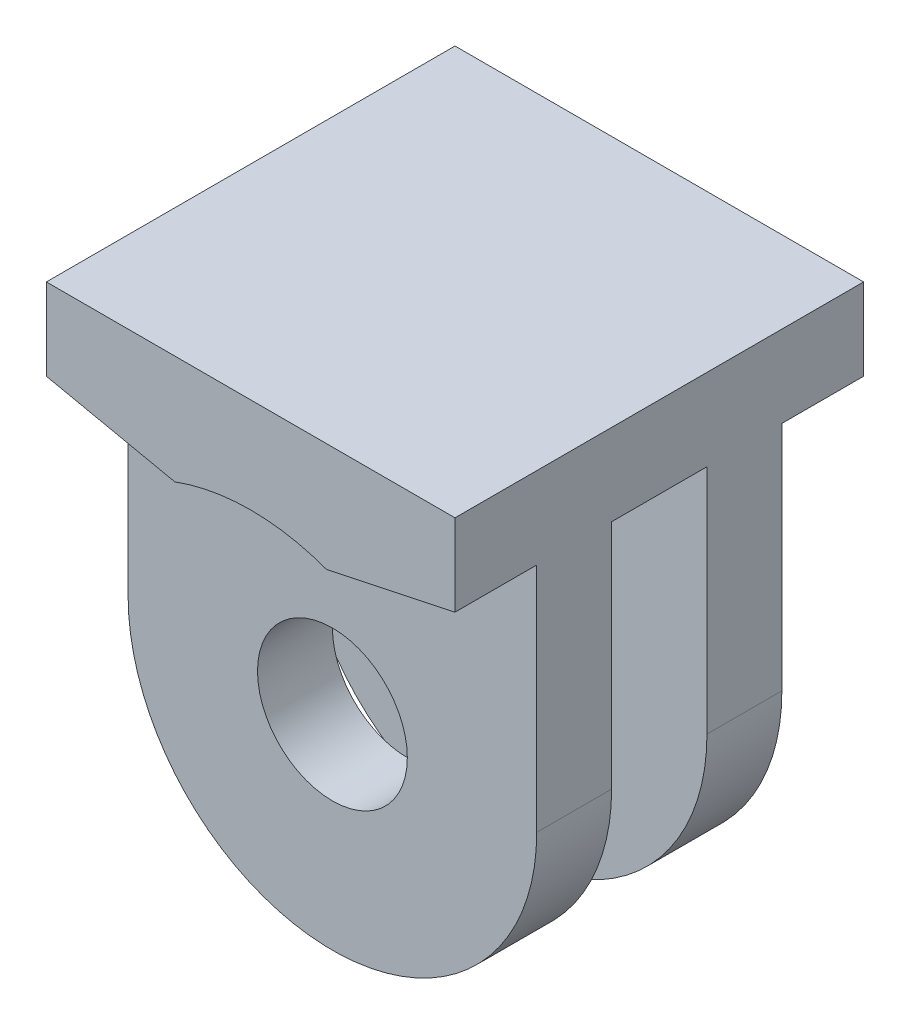
from build123d import *

# Parameters (mm, degrees)
SKETCH1_W           = 15
SKETCH1_H           = 7.5
BOSS_EXTRUDE1_DEPTH = 4
SKETCH3_W           = 15
SKETCH3_H           = 2.75
BOSS_EXTRUDE3_DEPTH = 15
CUT_EXTRUDE2_DEPTH  = 22.685248442
SKETCH6_R           = 2.75
CUT_EXTRUDE3_DEPTH  = 23.5
SKETCH10_R          = 8
CUT_EXTRUDE6_DEPTH  = 3
CUT_EXTRUDE9_START  = -1.75
SKETCH13_R          = 8
CUT_EXTRUDE9_DEPTH  = 1.75
CUT_EXTRUDE8_DEPTH  = 3
CUT_EXTRUDE10_DEPTH = 1.75


with BuildPart() as part:
    # Sketch1 → Boss-Extrude1 (new body)
    with BuildSketch(Plane(origin=(0, 0, 0), x_dir=(1, 0, 0), z_dir=(0, 1, 0))):
        with Locations((7.5, 3.75)):
            Rectangle(SKETCH1_W, SKETCH1_H)
    extrude(amount=BOSS_EXTRUDE1_DEPTH)

    # Sketch3 → Boss-Extrude3 (add)
    with BuildSketch(Plane.XZ):
        with Locations((7.5, -3.125)):
            Rectangle(SKETCH3_W, SKETCH3_H)
    extrude(amount=BOSS_EXTRUDE3_DEPTH)

    # Sketch5 → Cut-Extrude2 (cut, through all)
    with BuildSketch(Plane(origin=(0, 0, -4.5), x_dir=(-1, 0, 0), z_dir=(0, 0, -1))):
        with BuildLine():
            Line((-15, -7.5), (-15, -17.341994959))
            Line((-15, -17.341994959), (0, -17.341994959))
            Line((0, -17.341994959), (0, -7.5))
            ThreePointArc((0, -7.5), (-7.5, -15), (-15, -7.5))
        make_face()
    extrude(amount=-CUT_EXTRUDE2_DEPTH, mode=Mode.SUBTRACT)

    # Sketch6 → Cut-Extrude3 (cut, through all)
    with BuildSketch(Plane(origin=(0, 0, -7.5), x_dir=(-1, 0, 0), z_dir=(0, 0, -1))):
        with Locations((-7.5, -7.5)):
            Circle(SKETCH6_R)
    extrude(amount=-CUT_EXTRUDE3_DEPTH, mode=Mode.SUBTRACT)

    # Sketch10 → Cut-Extrude6 (cut)
    with BuildSketch(Plane(origin=(0, 0, -7.5), x_dir=(-1, 0, 0), z_dir=(0, 0, -1))):
        with Locations((-7.5, -7.5)):
            Circle(SKETCH10_R)
    extrude(amount=-CUT_EXTRUDE6_DEPTH, mode=Mode.SUBTRACT)

    # Sketch13 → Cut-Extrude9 (cut)
    with BuildSketch(Plane.XY.offset(CUT_EXTRUDE9_START)):
        with Locations((7.5, -7.5)):
            Circle(SKETCH13_R)
    extrude(amount=CUT_EXTRUDE9_DEPTH, mode=Mode.SUBTRACT)

    # Sketch12 → Cut-Extrude8 (cut)
    with BuildSketch(Plane(origin=(0, 0, -7.5), x_dir=(-1, 0, 0), z_dir=(0, 0, -1))):
        Polygon((-10.283882181, 0), (-15, 1), (-15, 0), align=None)
        Polygon((-4.716117819, 0), (0, 1), (0, 0), align=None)
    extrude(amount=-CUT_EXTRUDE8_DEPTH, mode=Mode.SUBTRACT)

    # Sketch14 → Cut-Extrude10 (cut)
    with BuildSketch(Plane.XY):
        Polygon((4.716117819, 0), (0, 1), (0, 0), align=None)
        Polygon((10.283882181, 0), (15, 1), (15, 0), align=None)
    extrude(amount=-CUT_EXTRUDE10_DEPTH, mode=Mode.SUBTRACT)

    # Mirror1: part across plane


with BuildPart() as part_1:
    add(part.part)
    add(part.part.mirror(Plane(origin=(0, 4, 0), x_dir=(1, 0, 0), z_dir=(0, 0, -1))))


solid = part_1.part
